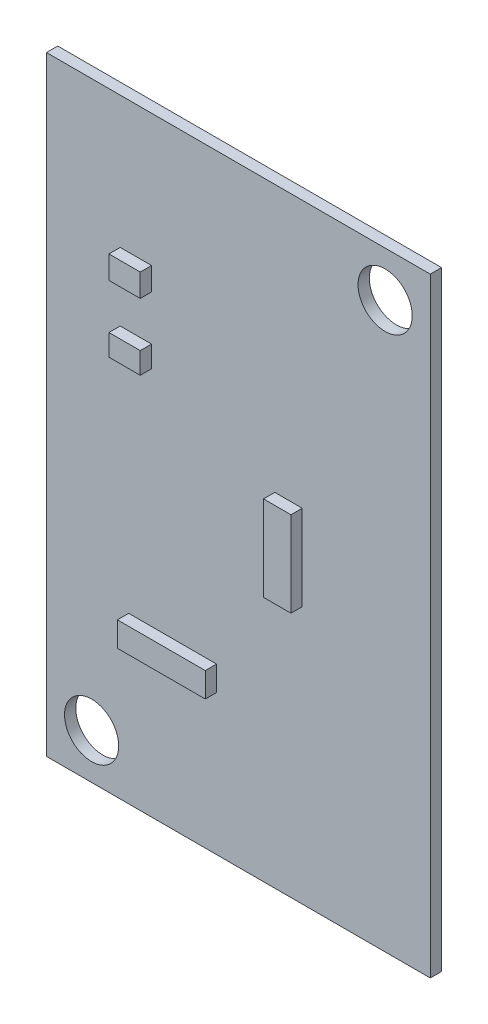
from build123d import *

# Parameters (mm, degrees)
CROQUIS1_W              = 17
CROQUIS1_H              = 27
SALIENTE_EXTRUIR1_DEPTH = 0.5
CROQUIS2_R              = 1.2
CORTAR_EXTRUIR1_DEPTH   = 0.5
CROQUIS3_W              = 1.387036679
CROQUIS3_H              = 1.014497707
CROQUIS3_H_2            = 0.94749306
CROQUIS3_W_2            = 1.216641307
CROQUIS3_H_3            = 3.776719189
CROQUIS3_W_3            = 3.892395648
CROQUIS3_H_4            = 1.091909055
SALIENTE_EXTRUIR2_DEPTH = 0.5


with BuildPart() as part:
    # Croquis1 → Saliente-Extruir1 (new body)
    with BuildSketch(Plane.XY):
        with Locations((8.5, 13.5)):
            Rectangle(CROQUIS1_W, CROQUIS1_H)
    extrude(amount=SALIENTE_EXTRUIR1_DEPTH)

    # Croquis2 → Cortar-Extruir1 (cut)
    with BuildSketch(Plane.XY.offset(0.5)):
        with Locations((2, 2)):
            Circle(CROQUIS2_R)
        with Locations((15, 25)):
            Circle(CROQUIS2_R)
    extrude(amount=-CORTAR_EXTRUIR1_DEPTH, mode=Mode.SUBTRACT)

    # Croquis3 → Saliente-Extruir2 (add)
    with BuildSketch(Plane.XY.offset(0.5)):
        with Locations((3.960596796, 20.650173654)):
            Rectangle(CROQUIS3_W, CROQUIS3_H)
        with Locations((3.960596796, 17.670424265)):
            Rectangle(CROQUIS3_W, CROQUIS3_H_2)
        with Locations((10.721614084, 13.296281172)):
            Rectangle(CROQUIS3_W_2, CROQUIS3_H_3)
        with Locations((5.588615761, 6.764486289)):
            Rectangle(CROQUIS3_W_3, CROQUIS3_H_4)
    extrude(amount=SALIENTE_EXTRUIR2_DEPTH)


solid = part.part
